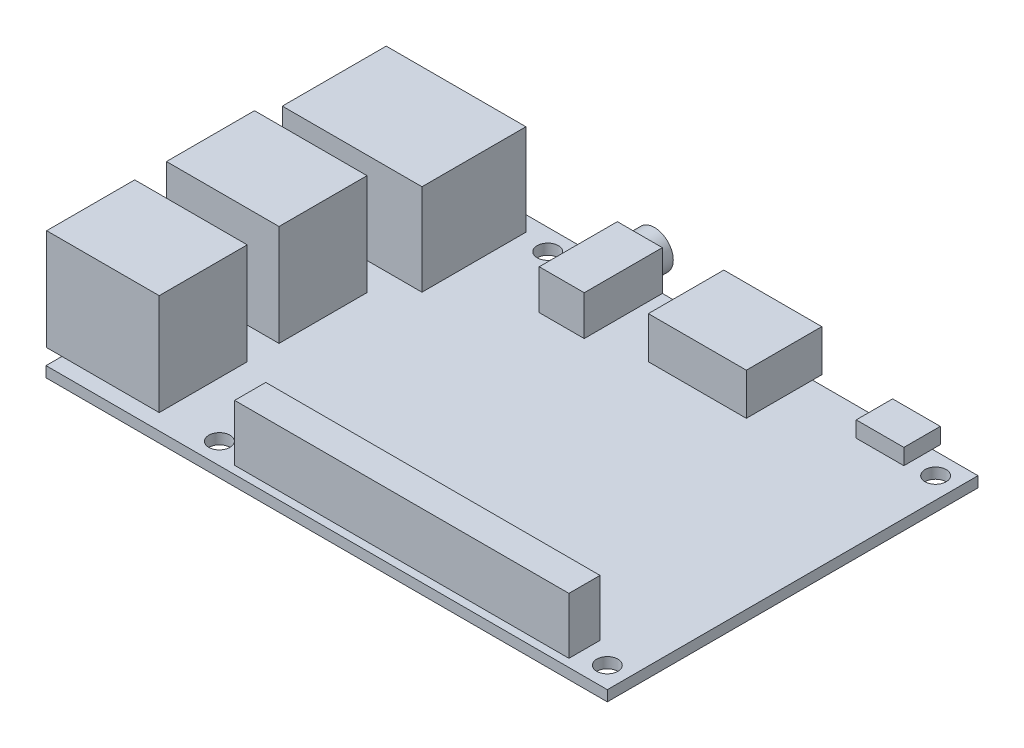
from build123d import *

# Parameters (mm, degrees)
SKETCH1_W            = 84.8
SKETCH1_H            = 56
BOSS_EXTRUDE1_DEPTH  = 1.6
M3_CLEARANCE_SLOT1_D = 3.2
SKETCH5_W            = 50.5
SKETCH5_H            = 4.7
BOSS_EXTRUDE2_DEPTH  = 8.5
SKETCH6_W            = 21.1
SKETCH6_H            = 15.7
BOSS_EXTRUDE3_DEPTH  = 13.8
SKETCH7_W            = 17
SKETCH7_H            = 13.3
BOSS_EXTRUDE4_DEPTH  = 15.3
SKETCH8_W            = 7.2
SKETCH8_H            = 5.5
BOSS_EXTRUDE5_DEPTH  = 2.4
SKETCH9_W            = 14.8
SKETCH9_H            = 11.4
BOSS_EXTRUDE6_DEPTH  = 6.3
SKETCH10_W           = 6.8
SKETCH10_H           = 11.8
BOSS_EXTRUDE7_DEPTH  = 6
SKETCH11_R           = 2.85
BOSS_EXTRUDE8_DEPTH  = 2.2


with BuildPart() as part:
    # Sketch1 → Boss-Extrude1 (new body)
    with BuildSketch(Plane(origin=(0, 0, 0), x_dir=(1, 0, 0), z_dir=(0, 1, 0))):
        with Locations((42.4, 28)):
            Rectangle(SKETCH1_W, SKETCH1_H)
    extrude(amount=BOSS_EXTRUDE1_DEPTH)

    # M3 Clearance Slot1 (through all)
    with Locations(Plane(origin=(0, 1.6, 0), x_dir=(1, 0, 0), z_dir=(0, 1, 0))):
        with Locations((81.6, 3.2), (81.6, 52.8), (23, 52.8), (23, 3.2)):
            Hole(M3_CLEARANCE_SLOT1_D / 2)

    # Sketch5 → Boss-Extrude2 (add)
    with BuildSketch(Plane(origin=(0, 1.6, 0), x_dir=(1, 0, 0), z_dir=(0, 1, 0))):
        with Locations((52.55, 3.55)):
            Rectangle(SKETCH5_W, SKETCH5_H)
    extrude(amount=BOSS_EXTRUDE2_DEPTH)

    # Sketch6 → Boss-Extrude3 (add)
    with BuildSketch(Plane(origin=(0, 1.6, 0), x_dir=(1, 0, 0), z_dir=(0, 1, 0))):
        with Locations((8.25, 45.85)):
            Rectangle(SKETCH6_W, SKETCH6_H)
    extrude(amount=BOSS_EXTRUDE3_DEPTH)

    # Sketch7 → Boss-Extrude4 (add)
    with BuildSketch(Plane(origin=(0, 1.6, 0), x_dir=(1, 0, 0), z_dir=(0, 1, 0))):
        with Locations((6.2, 27.15)):
            Rectangle(SKETCH7_W, SKETCH7_H)
        with Locations((6.2, 9.05)):
            Rectangle(SKETCH7_W, SKETCH7_H)
    extrude(amount=BOSS_EXTRUDE4_DEPTH)

    # Sketch8 → Boss-Extrude5 (add)
    with BuildSketch(Plane(origin=(0, 1.6, 0), x_dir=(1, 0, 0), z_dir=(0, 1, 0))):
        with Locations((74.3, 54.45)):
            Rectangle(SKETCH8_W, SKETCH8_H)
    extrude(amount=BOSS_EXTRUDE5_DEPTH)

    # Sketch9 → Boss-Extrude6 (add)
    with BuildSketch(Plane(origin=(0, 1.6, 0), x_dir=(1, 0, 0), z_dir=(0, 1, 0))):
        with Locations((52.4, 51.7)):
            Rectangle(SKETCH9_W, SKETCH9_H)
    extrude(amount=BOSS_EXTRUDE6_DEPTH)

    # Sketch10 → Boss-Extrude7 (add)
    with BuildSketch(Plane(origin=(0, 1.6, 0), x_dir=(1, 0, 0), z_dir=(0, 1, 0))):
        with Locations((33.722871629, 50.09)):
            Rectangle(SKETCH10_W, SKETCH10_H)
    extrude(amount=BOSS_EXTRUDE7_DEPTH)

    # Sketch11 → Boss-Extrude8 (add)
    with BuildSketch(Plane(origin=(0, 0, -55.99), x_dir=(-1, 0, 0), z_dir=(0, 0, -1))):
        with Locations(Location((-33.722871629, 4.6, 0), (0, 0, 180))):
            Circle(SKETCH11_R)
    extrude(amount=BOSS_EXTRUDE8_DEPTH)


solid = part.part
